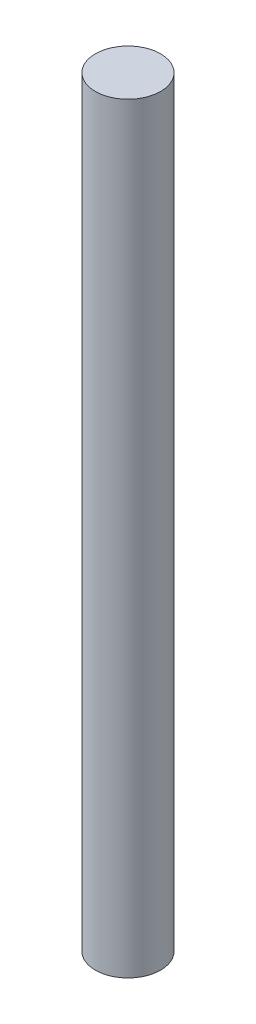
from build123d import *

# Parameters (mm, degrees)
SKETCH1_R           = 1.905
BOSS_EXTRUDE1_DEPTH = 44.45


with BuildPart() as part:
    # Sketch1 → Boss-Extrude1 (new body)
    with BuildSketch(Plane(origin=(0, 0, 0), x_dir=(1, 0, 0), z_dir=(0, 1, 0))):
        with Locations(Location((0, 0, 0), (0, 0, 270))):
            Circle(SKETCH1_R)
    extrude(amount=BOSS_EXTRUDE1_DEPTH)


solid = part.part
